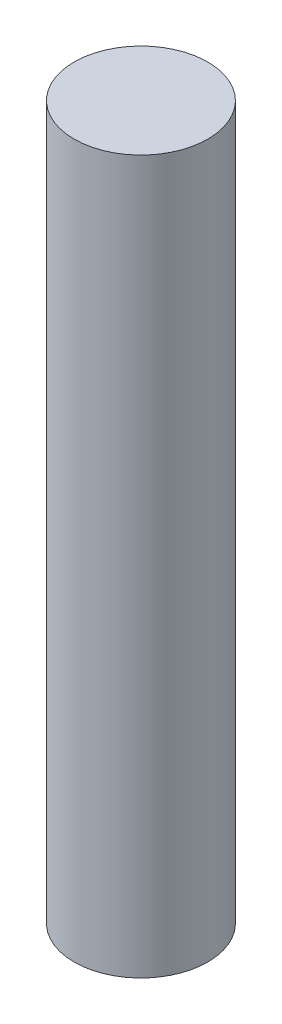
from build123d import *

# Parameters (mm, degrees)
SKETCH4_R           = 9.525
BOSS_EXTRUDE2_DEPTH = 101.6


with BuildPart() as part:
    # Sketch4 → Boss-Extrude2 (new body)
    with BuildSketch(Plane(origin=(0, 0, 0), x_dir=(1, 0, 0), z_dir=(0, 1, 0))):
        with Locations(Location((0, 0, 0), (0, 0, 270))):
            Circle(SKETCH4_R)
    extrude(amount=BOSS_EXTRUDE2_DEPTH)


solid = part.part
